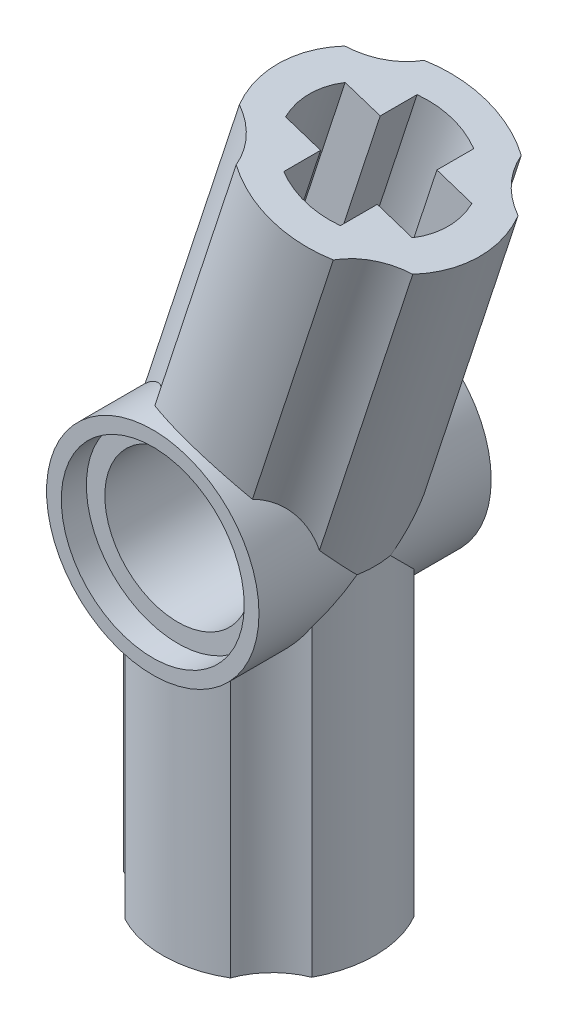
from build123d import *

# Parameters (mm, degrees)
CROQUIS1_R                   = 3.6
CROQUIS1_R_2                 = 3.1
SALIENTE_EXTRUIR1_DEPTH      = 7.87
SALIENTE_EXTRUIR2_START      = 0.85
CROQUIS1_3_R                 = 3.1
CROQUIS1_3_R_2               = 2.475
SALIENTE_EXTRUIR2_DEPTH      = 6.17
SALIENTE_EXTRUIR3_REACH      = 13.518
SALIENTE_EXTRUIR3_END_RADIUS = 3.6
SALIENTE_EXTRUIR4_START      = -8
SALIENTE_EXTRUIR4_DEPTH      = 8
SALIENTE_EXTRUIR5_REACH      = 20.306
SALIENTE_EXTRUIR5_END_RADIUS = 3.6
SALIENTE_EXTRUIR6_START      = -8
SALIENTE_EXTRUIR6_DEPTH      = 8


with BuildPart() as part:
    # Croquis1 → Saliente-Extruir1 (new body)
    with BuildSketch(Plane.XY):
        Circle(CROQUIS1_R)
        Circle(CROQUIS1_R_2, mode=Mode.SUBTRACT)
    extrude(amount=SALIENTE_EXTRUIR1_DEPTH)

    # Croquis1<3> → Saliente-Extruir2 (add)
    with BuildSketch(Plane.XY.offset(SALIENTE_EXTRUIR2_START)):
        Circle(CROQUIS1_3_R)
        Circle(CROQUIS1_3_R_2, mode=Mode.SUBTRACT)
    extrude(amount=SALIENTE_EXTRUIR2_DEPTH)

    # Saliente-Extruir3: up to this cylinder (the profile starts outside it)
    saliente_extruir3_end = Plane(origin=(0, 0, 6.19961), z_dir=(0, 0, -1)) * Cylinder(SALIENTE_EXTRUIR3_END_RADIUS, 35.236000000000004, mode=Mode.PRIVATE)
    # Croquis2 → Saliente-Extruir3 (add, up to the surface)
    with BuildSketch(Plane(origin=(0, -4, 0), x_dir=(1, 0, 0), z_dir=(0, 1, 0)), mode=Mode.PRIVATE) as saliente_extruir3_sk1:
        with BuildLine():
            ThreePointArc((-1.7124779696357202, -7.101610049171246), (0.05399392602494436, -7.534595068330939), (1.806684459564255, -7.048822612733265))
            ThreePointArc((1.806684459564255, -7.048822612733265), (2.337681630948243, -6.203587592595142), (3.1666100491712275, -5.647477969635754))
            ThreePointArc((3.1666100491712275, -5.647477969635754), (3.599595068330938, -3.881006073975069), (3.1138226127332604, -2.1283155404357355))
            ThreePointArc((3.1138226127332604, -2.1283155404357355), (2.268587592595135, -1.597318369051751), (1.7124779696357444, -0.7683899508287686))
            ThreePointArc((1.7124779696357444, -0.7683899508287686), (-0.0539939260249431, -0.3354049316690628), (-1.806684459564274, -0.8211773872667488))
            ThreePointArc((-1.806684459564274, -0.8211773872667488), (-2.337681630948256, -1.6664124074048765), (-3.166610049171237, -2.22252203036427))
            ThreePointArc((-3.166610049171237, -2.22252203036427), (-3.599595068330935, -3.9889939260249565), (-3.1138226127332462, -5.741684459564288))
            ThreePointArc((-3.1138226127332462, -5.741684459564288), (-2.268587592595116, -6.272681630948267), (-1.7124779696357202, -7.101610049171246))
        make_face()
        with BuildLine():
            Line((-1.01, -6.194540882568846), (-1.01, -4.944999999999999))
            Line((-1.01, -4.944999999999999), (-2.2595408825688463, -4.944999999999999))
            ThreePointArc((-2.2595408825688463, -4.944999999999999), (-2.475, -3.9349999999999996), (-2.2595408825688463, -2.9250000000000007))
            Line((-2.2595408825688463, -2.9250000000000007), (-1.01, -2.9250000000000007))
            Line((-1.01, -2.9250000000000007), (-1.01, -1.675459117431154))
            ThreePointArc((-1.01, -1.675459117431154), (1.5e-16, -1.4600000000000004), (1.01, -1.675459117431154))
            Line((1.01, -1.675459117431154), (1.01, -2.9250000000000007))
            Line((1.01, -2.9250000000000007), (2.2595408825688463, -2.9250000000000007))
            ThreePointArc((2.2595408825688463, -2.9250000000000007), (2.475, -3.935), (2.2595408825688463, -4.944999999999999))
            Line((2.2595408825688463, -4.944999999999999), (1.01, -4.944999999999999))
            Line((1.01, -4.944999999999999), (1.01, -6.194540882568846))
            ThreePointArc((1.01, -6.194540882568846), (1.5e-16, -6.41), (-1.01, -6.194540882568846))
        make_face(mode=Mode.SUBTRACT)
    saliente_extruir3_tool1 = extrude(saliente_extruir3_sk1.sketch, amount=SALIENTE_EXTRUIR3_REACH, mode=Mode.PRIVATE) - saliente_extruir3_end
    add(saliente_extruir3_tool1.solids().sort_by_distance((-2.197676, -4, 6.19961))[0])

    # Croquis2<3> → Saliente-Extruir4 (add)
    with BuildSketch(Plane(origin=(0, -4, 0), x_dir=(1, 0, 0), z_dir=(0, 1, 0)).offset(SALIENTE_EXTRUIR4_START)):
        with BuildLine():
            ThreePointArc((-3.166610049171237, -2.22252203036427), (-2.337681630948256, -1.6664124074048765), (-1.806684459564274, -0.8211773872667488))
            ThreePointArc((-1.806684459564274, -0.8211773872667488), (-0.0539939260249431, -0.3354049316690628), (1.7124779696357444, -0.7683899508287686))
            ThreePointArc((1.7124779696357444, -0.7683899508287686), (2.268587592595135, -1.597318369051751), (3.1138226127332604, -2.1283155404357355))
            ThreePointArc((3.1138226127332604, -2.1283155404357355), (3.599595068330938, -3.881006073975069), (3.1666100491712275, -5.647477969635754))
            ThreePointArc((3.1666100491712275, -5.647477969635754), (2.337681630948243, -6.203587592595142), (1.806684459564255, -7.048822612733265))
            ThreePointArc((1.806684459564255, -7.048822612733265), (0.05399392602494436, -7.534595068330939), (-1.7124779696357202, -7.101610049171246))
            ThreePointArc((-1.7124779696357202, -7.101610049171246), (-2.268587592595116, -6.272681630948267), (-3.1138226127332462, -5.741684459564288))
            ThreePointArc((-3.1138226127332462, -5.741684459564288), (-3.599595068330935, -3.9889939260249565), (-3.166610049171237, -2.22252203036427))
        make_face()
        with BuildLine():
            ThreePointArc((-2.2595408825688463, -2.9250000000000007), (-2.475, -3.9349999999999996), (-2.2595408825688463, -4.944999999999999))
            Line((-2.2595408825688463, -4.944999999999999), (-1.01, -4.944999999999999))
            Line((-1.01, -4.944999999999999), (-1.01, -6.194540882568846))
            ThreePointArc((-1.01, -6.194540882568846), (1.5e-16, -6.41), (1.01, -6.194540882568846))
            Line((1.01, -6.194540882568846), (1.01, -4.944999999999999))
            Line((1.01, -4.944999999999999), (2.2595408825688463, -4.944999999999999))
            ThreePointArc((2.2595408825688463, -4.944999999999999), (2.475, -3.935), (2.2595408825688463, -2.9250000000000007))
            Line((2.2595408825688463, -2.9250000000000007), (1.01, -2.9250000000000007))
            Line((1.01, -2.9250000000000007), (1.01, -1.675459117431154))
            ThreePointArc((1.01, -1.675459117431154), (1.5e-16, -1.4600000000000004), (-1.01, -1.675459117431154))
            Line((-1.01, -1.675459117431154), (-1.01, -2.9250000000000007))
            Line((-1.01, -2.9250000000000007), (-2.2595408825688463, -2.9250000000000007))
        make_face(mode=Mode.SUBTRACT)
    extrude(amount=SALIENTE_EXTRUIR4_DEPTH)

    # Saliente-Extruir5: up to this cylinder (the profile starts outside it)
    saliente_extruir5_end = Plane(origin=(0, 0, 3.935), z_dir=(0, 0, -1)) * Cylinder(SALIENTE_EXTRUIR5_END_RADIUS, 48.812000000000005, mode=Mode.PRIVATE)
    # Croquis7 → Saliente-Extruir5 (add, up to the surface)
    with BuildSketch(Plane(origin=(1.2413784725111818, 3.8024964809958477, 0), x_dir=(0, 0, 1), z_dir=(-0.31034461812779546, -0.9506241202489619, 0)), mode=Mode.PRIVATE) as saliente_extruir5_sk1:
        with BuildLine():
            ThreePointArc((2.222522030364279, -3.1666100491712452), (3.9889939260249445, -3.5995950683309377), (5.741684459564254, -3.113822612733264))
            ThreePointArc((5.741684459564254, -3.113822612733264), (6.272681630948287, -2.2685875925951686), (7.101610049171227, -1.7124779696357533))
            ThreePointArc((7.101610049171227, -1.7124779696357533), (7.534595068330938, 0.0539939260249318), (7.048822612733259, 1.8066844595642648))
            ThreePointArc((7.048822612733259, 1.8066844595642648), (6.203587592595132, 2.337681630948248), (5.647477969635745, 3.1666100491712332))
            ThreePointArc((5.647477969635745, 3.1666100491712332), (3.881006073975058, 3.599595068330939), (2.1283155404357252, 3.113822612733254))
            ThreePointArc((2.1283155404357252, 3.113822612733254), (1.5973183690517558, 2.268587592595114), (0.7683899508287607, 1.7124779696357326))
            ThreePointArc((0.7683899508287607, 1.7124779696357326), (0.33540493166906193, -0.05399392602495561), (0.8211773872667536, -1.8066844595642866))
            ThreePointArc((0.8211773872667536, -1.8066844595642866), (1.6664124074048823, -2.337681630948267), (2.222522030364279, -3.1666100491712452))
        make_face()
    saliente_extruir5_tool1 = extrude(saliente_extruir5_sk1.sketch, amount=SALIENTE_EXTRUIR5_REACH, mode=Mode.PRIVATE) - saliente_extruir5_end
    add(saliente_extruir5_tool1.solids().sort_by_distance((1.241378, 3.802496, 3.935))[0])

    # Croquis7<3> → Saliente-Extruir6 (add)
    with BuildSketch(Plane(origin=(1.2413784725111818, 3.8024964809958477, 0), x_dir=(0, 0, 1), z_dir=(-0.31034461812779546, -0.9506241202489619, 0)).offset(SALIENTE_EXTRUIR6_START)):
        with BuildLine():
            ThreePointArc((0.7683899508287607, 1.7124779696357326), (1.5973183690517558, 2.268587592595114), (2.1283155404357252, 3.113822612733254))
            ThreePointArc((2.1283155404357252, 3.113822612733254), (3.881006073975058, 3.599595068330939), (5.647477969635745, 3.1666100491712332))
            ThreePointArc((5.647477969635745, 3.1666100491712332), (6.203587592595132, 2.337681630948248), (7.048822612733259, 1.8066844595642648))
            ThreePointArc((7.048822612733259, 1.8066844595642648), (7.534595068330938, 0.0539939260249318), (7.101610049171227, -1.7124779696357533))
            ThreePointArc((7.101610049171227, -1.7124779696357533), (6.272681630948287, -2.2685875925951686), (5.741684459564254, -3.113822612733264))
            ThreePointArc((5.741684459564254, -3.113822612733264), (3.9889939260249445, -3.5995950683309377), (2.222522030364279, -3.1666100491712452))
            ThreePointArc((2.222522030364279, -3.1666100491712452), (1.6664124074048823, -2.337681630948267), (0.8211773872667536, -1.8066844595642866))
            ThreePointArc((0.8211773872667536, -1.8066844595642866), (0.33540493166906193, -0.05399392602495561), (0.7683899508287607, 1.7124779696357326))
        make_face()
        with BuildLine():
            ThreePointArc((1.675459117431154, 1.010000000000001), (1.4600000000000004, 1.17e-15), (1.675459117431154, -1.0099999999999991))
            Line((1.675459117431154, -1.0099999999999991), (2.925, -1.0099999999999991))
            Line((2.925, -1.0099999999999991), (2.925, -2.2595408825688454))
            ThreePointArc((2.925, -2.2595408825688454), (3.934999999999999, -2.474999999999999), (4.944999999999999, -2.259540882568846))
            Line((4.944999999999999, -2.259540882568846), (4.944999999999999, -1.009999999999999))
            Line((4.944999999999999, -1.009999999999999), (6.194540882568846, -1.0099999999999987))
            ThreePointArc((6.194540882568846, -1.0099999999999987), (6.41, 1e-15), (6.194540882568846, 1.010000000000001))
            Line((6.194540882568846, 1.010000000000001), (4.944999999999999, 1.010000000000001))
            Line((4.944999999999999, 1.010000000000001), (4.944999999999999, 2.259540882568847))
            ThreePointArc((4.944999999999999, 2.259540882568847), (3.9349999999999996, 2.475000000000001), (2.925, 2.2595408825688468))
            Line((2.925, 2.2595408825688468), (2.925, 1.010000000000001))
            Line((2.925, 1.010000000000001), (1.675459117431154, 1.010000000000001))
        make_face(mode=Mode.SUBTRACT)
    extrude(amount=SALIENTE_EXTRUIR6_DEPTH)


solid = part.part
